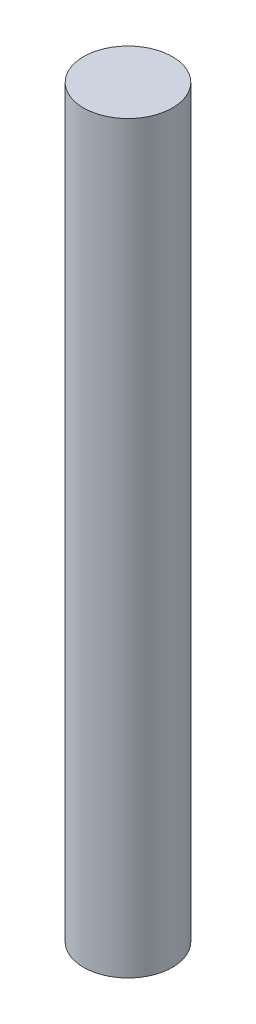
from build123d import *

# Parameters (mm, degrees)
SKETCH1_R           = 5.08
BOSS_EXTRUDE1_DEPTH = 85.09


with BuildPart() as part:
    # Sketch1 → Boss-Extrude1 (new body)
    with BuildSketch(Plane(origin=(0, 0, 0), x_dir=(1, 0, 0), z_dir=(0, 1, 0))):
        with Locations(Location((0, 0, 0), (0, 0, 270))):
            Circle(SKETCH1_R)
    extrude(amount=BOSS_EXTRUDE1_DEPTH)


solid = part.part
